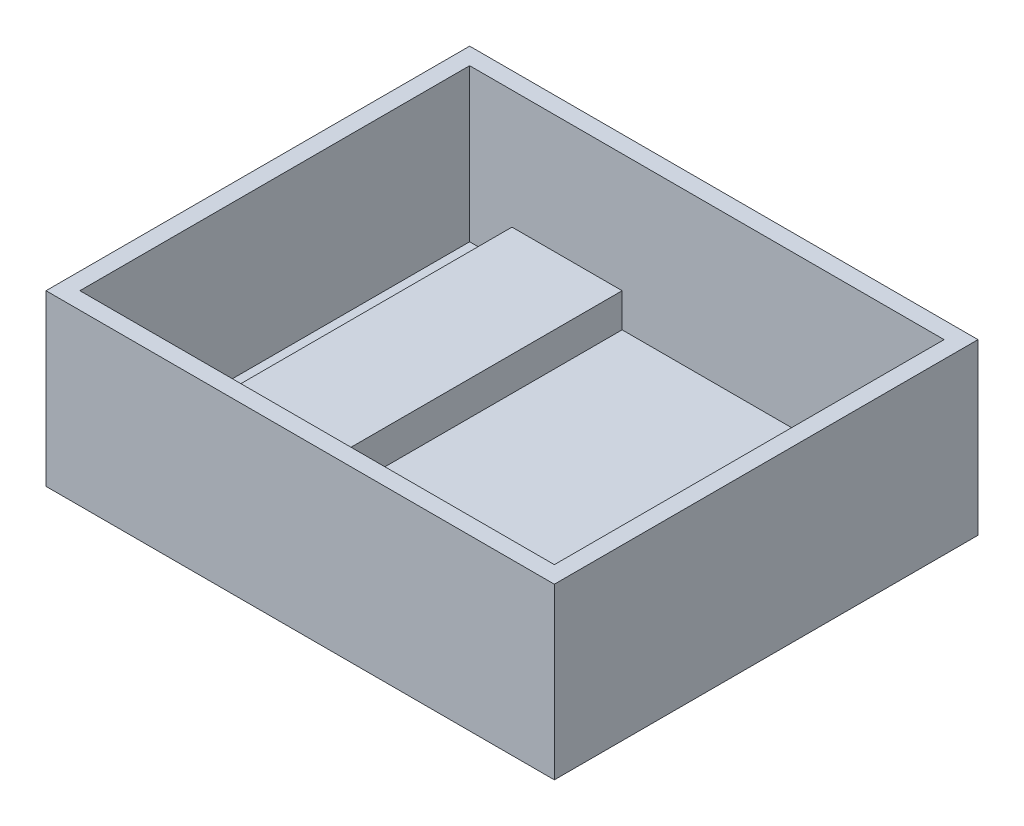
from build123d import *

# Parameters (mm, degrees)
SKETCH1_W           = 120
SKETCH1_H           = 100
BOSS_EXTRUDE1_DEPTH = 40
SKETCH2_W           = 112
SKETCH2_H           = 92
CUT_EXTRUDE1_DEPTH  = 36
SKETCH3_W           = 26
SKETCH3_H           = 70
BOSS_EXTRUDE3_DEPTH = 8


with BuildPart() as part:
    # Sketch1 → Boss-Extrude1 (new body)
    with BuildSketch(Plane(origin=(0, 0, 0), x_dir=(1, 0, 0), z_dir=(0, 1, 0))):
        with Locations((-10.571222942, 10.082692781)):
            Rectangle(SKETCH1_W, SKETCH1_H)
    extrude(amount=BOSS_EXTRUDE1_DEPTH)

    # Sketch2 → Cut-Extrude1 (cut)
    with BuildSketch(Plane(origin=(0, 40, 0), x_dir=(1, 0, 0), z_dir=(0, 1, 0))):
        with Locations((-10.571222942, 10.082692781)):
            Rectangle(SKETCH2_W, SKETCH2_H)
    extrude(amount=-CUT_EXTRUDE1_DEPTH, mode=Mode.SUBTRACT)

    # Sketch3 → Boss-Extrude3 (add)
    with BuildSketch(Plane(origin=(0, 4, 0), x_dir=(1, 0, 0), z_dir=(0, 1, 0))):
        with Locations((-43.571222942, 25.082692781)):
            Rectangle(SKETCH3_W, SKETCH3_H)
    extrude(amount=BOSS_EXTRUDE3_DEPTH)


solid = part.part
